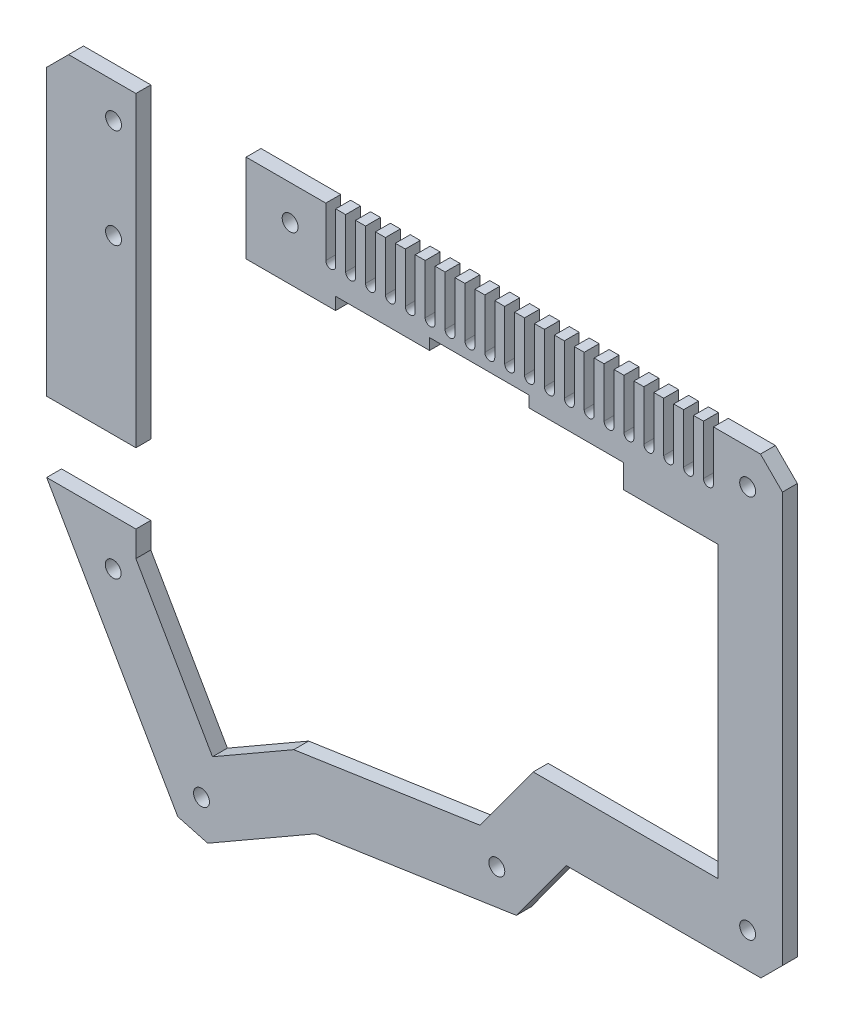
from build123d import *

# Parameters (mm, degrees)
ESQUISSE1_R             = 1.6
BOSS_EXTRU_1_DEPTH      = 3
ENL_V_MAT_EXTRU_1_DEPTH = 10
ESQUISSE3_W             = 19.456160795
ESQUISSE3_H             = 14.150463698
ENL_V_MAT_EXTRU_2_DEPTH = 10


with BuildPart() as part:
    # Esquisse1 → Boss.-Extru.1 (new body)
    with BuildSketch(Plane.XY):
        Polygon((-119.346315028, 5.320852512), (-119.346315028, 1.570515597), (-119.346382005, -12.429484403), (-101.345774335, -12.429484403), (-101.345774335, -9.929307079), (-82.434988213, -9.929307079), (-82.434988213, -7.679926158), (-62.433711482, -7.681038584), (-62.433711482, -9.929307079), (-43.432363825, -9.929307079), (-43.432363825, -14.679643994), (-24.429668504, -14.679643994), (-24.429668504, -72.933633781), (-61.577157206, -72.933633781), (-72.263087593, -87.572177036), (-109.761976756, -93.1463556), (-126.111124489, -102.556497988), (-141.52282508, -75.732017442), (-141.52282508, 5.320852512), (-155.064772313, 5.320852512), (-159.478985875, 0.90663895), (-159.478985875, -70.574320891), (-133.100653393, -116.486520024), (-127.076613358, -118.11178196), (-105.412894174, -105.642711064), (-64.97062335, -99.631001274), (-54.971738012, -85.933633781), (-15.753320523, -85.933633781), (-11.429668504, -81.609981762), (-11.429668504, 0.900815081), (-15.84946011, 5.320852512), align=None)
        with Locations((-146.02282508, -21.680525068)):
            Circle(ESQUISSE1_R, mode=Mode.SUBTRACT)
        with Locations((-18.429668504, -1.684542717)):
            Circle(ESQUISSE1_R, mode=Mode.SUBTRACT)
        with Locations((-110.487646531, -1.678365923)):
            Circle(ESQUISSE1_R, mode=Mode.SUBTRACT)
        with Locations((-146.02282508, -1.677868186)):
            Circle(ESQUISSE1_R, mode=Mode.SUBTRACT)
        with Locations((-146.0923789, -79.822656053)):
            Circle(ESQUISSE1_R, mode=Mode.SUBTRACT)
        with Locations((-128.322250168, -110.752044388)):
            Circle(ESQUISSE1_R, mode=Mode.SUBTRACT)
        with Locations((-68.897334865, -93.137788223)):
            Circle(ESQUISSE1_R, mode=Mode.SUBTRACT)
        with Locations((-18.429668504, -78.933633781)):
            Circle(ESQUISSE1_R, mode=Mode.SUBTRACT)
    extrude(amount=BOSS_EXTRU_1_DEPTH)

    # Esquisse2 → Enlèv. mat.-Extru.1 (cut)
    with BuildSketch(Plane.XY.offset(3)):
        with BuildLine():
            Line((-25.315456398, 8.615924369), (-25.315456398, -4.679147488))
            ThreePointArc((-25.315456398, -4.679147488), (-26.315456398, -5.679147488), (-27.315456398, -4.679147488))
            Line((-27.315456398, -4.679147488), (-27.315456398, 8.615924369))
            ThreePointArc((-27.315456398, 8.615924369), (-26.315456398, 9.615924369), (-25.315456398, 8.615924369))
        make_face()
        with BuildLine():
            Line((-29.315456398, 8.615924369), (-29.315456398, -4.679147488))
            ThreePointArc((-29.315456398, -4.679147488), (-30.315456398, -5.679147488), (-31.315456398, -4.679147488))
            Line((-31.315456398, -4.679147488), (-31.315456398, 8.615924369))
            ThreePointArc((-31.315456398, 8.615924369), (-30.315456398, 9.615924369), (-29.315456398, 8.615924369))
        make_face()
        with BuildLine():
            Line((-33.315456398, 8.615924369), (-33.315456398, -4.679147488))
            ThreePointArc((-33.315456398, -4.679147488), (-34.315456398, -5.679147488), (-35.315456398, -4.679147488))
            Line((-35.315456398, -4.679147488), (-35.315456398, 8.615924369))
            ThreePointArc((-35.315456398, 8.615924369), (-34.315456398, 9.615924369), (-33.315456398, 8.615924369))
        make_face()
        with BuildLine():
            Line((-37.315456398, 8.615924369), (-37.315456398, -4.679147488))
            ThreePointArc((-37.315456398, -4.679147488), (-38.315456398, -5.679147488), (-39.315456398, -4.679147488))
            Line((-39.315456398, -4.679147488), (-39.315456398, 8.615924369))
            ThreePointArc((-39.315456398, 8.615924369), (-38.315456398, 9.615924369), (-37.315456398, 8.615924369))
        make_face()
        with BuildLine():
            Line((-41.315456398, 8.615924369), (-41.315456398, -4.679147488))
            ThreePointArc((-41.315456398, -4.679147488), (-42.315456398, -5.679147488), (-43.315456398, -4.679147488))
            Line((-43.315456398, -4.679147488), (-43.315456398, 8.615924369))
            ThreePointArc((-43.315456398, 8.615924369), (-42.315456398, 9.615924369), (-41.315456398, 8.615924369))
        make_face()
        with BuildLine():
            Line((-45.315456398, 8.615924369), (-45.315456398, -4.679147488))
            ThreePointArc((-45.315456398, -4.679147488), (-46.315456398, -5.679147488), (-47.315456398, -4.679147488))
            Line((-47.315456398, -4.679147488), (-47.315456398, 8.615924369))
            ThreePointArc((-47.315456398, 8.615924369), (-46.315456398, 9.615924369), (-45.315456398, 8.615924369))
        make_face()
        with BuildLine():
            Line((-49.315456398, 8.615924369), (-49.315456398, -4.679147488))
            ThreePointArc((-49.315456398, -4.679147488), (-50.315456398, -5.679147488), (-51.315456398, -4.679147488))
            Line((-51.315456398, -4.679147488), (-51.315456398, 8.615924369))
            ThreePointArc((-51.315456398, 8.615924369), (-50.315456398, 9.615924369), (-49.315456398, 8.615924369))
        make_face()
        with BuildLine():
            Line((-53.315456398, 8.615924369), (-53.315456398, -4.679147488))
            ThreePointArc((-53.315456398, -4.679147488), (-54.315456398, -5.679147488), (-55.315456398, -4.679147488))
            Line((-55.315456398, -4.679147488), (-55.315456398, 8.615924369))
            ThreePointArc((-55.315456398, 8.615924369), (-54.315456398, 9.615924369), (-53.315456398, 8.615924369))
        make_face()
        with BuildLine():
            Line((-57.315456398, 8.615924369), (-57.315456398, -4.679147488))
            ThreePointArc((-57.315456398, -4.679147488), (-58.315456398, -5.679147488), (-59.315456398, -4.679147488))
            Line((-59.315456398, -4.679147488), (-59.315456398, 8.615924369))
            ThreePointArc((-59.315456398, 8.615924369), (-58.315456398, 9.615924369), (-57.315456398, 8.615924369))
        make_face()
        with BuildLine():
            Line((-61.315456398, 8.615924369), (-61.315456398, -4.679147488))
            ThreePointArc((-61.315456398, -4.679147488), (-62.315456398, -5.679147488), (-63.315456398, -4.679147488))
            Line((-63.315456398, -4.679147488), (-63.315456398, 8.615924369))
            ThreePointArc((-63.315456398, 8.615924369), (-62.315456398, 9.615924369), (-61.315456398, 8.615924369))
        make_face()
        with BuildLine():
            Line((-65.315456398, 8.615924369), (-65.315456398, -4.679147488))
            ThreePointArc((-65.315456398, -4.679147488), (-66.315456398, -5.679147488), (-67.315456398, -4.679147488))
            Line((-67.315456398, -4.679147488), (-67.315456398, 8.615924369))
            ThreePointArc((-67.315456398, 8.615924369), (-66.315456398, 9.615924369), (-65.315456398, 8.615924369))
        make_face()
        with BuildLine():
            Line((-69.315456398, 8.615924369), (-69.315456398, -4.679147488))
            ThreePointArc((-69.315456398, -4.679147488), (-70.315456398, -5.679147488), (-71.315456398, -4.679147488))
            Line((-71.315456398, -4.679147488), (-71.315456398, 8.615924369))
            ThreePointArc((-71.315456398, 8.615924369), (-70.315456398, 9.615924369), (-69.315456398, 8.615924369))
        make_face()
        with BuildLine():
            Line((-73.315456398, 8.615924369), (-73.315456398, -4.679147488))
            ThreePointArc((-73.315456398, -4.679147488), (-74.315456398, -5.679147488), (-75.315456398, -4.679147488))
            Line((-75.315456398, -4.679147488), (-75.315456398, 8.615924369))
            ThreePointArc((-75.315456398, 8.615924369), (-74.315456398, 9.615924369), (-73.315456398, 8.615924369))
        make_face()
        with BuildLine():
            Line((-77.315456398, 8.615924369), (-77.315456398, -4.679147488))
            ThreePointArc((-77.315456398, -4.679147488), (-78.315456398, -5.679147488), (-79.315456398, -4.679147488))
            Line((-79.315456398, -4.679147488), (-79.315456398, 8.615924369))
            ThreePointArc((-79.315456398, 8.615924369), (-78.315456398, 9.615924369), (-77.315456398, 8.615924369))
        make_face()
        with BuildLine():
            Line((-81.315456398, 8.615924369), (-81.315456398, -4.679147488))
            ThreePointArc((-81.315456398, -4.679147488), (-82.315456398, -5.679147488), (-83.315456398, -4.679147488))
            Line((-83.315456398, -4.679147488), (-83.315456398, 8.615924369))
            ThreePointArc((-83.315456398, 8.615924369), (-82.315456398, 9.615924369), (-81.315456398, 8.615924369))
        make_face()
        with BuildLine():
            Line((-85.315456398, 8.615924369), (-85.315456398, -4.679147488))
            ThreePointArc((-85.315456398, -4.679147488), (-86.315456398, -5.679147488), (-87.315456398, -4.679147488))
            Line((-87.315456398, -4.679147488), (-87.315456398, 8.615924369))
            ThreePointArc((-87.315456398, 8.615924369), (-86.315456398, 9.615924369), (-85.315456398, 8.615924369))
        make_face()
        with BuildLine():
            Line((-89.315456398, 8.615924369), (-89.315456398, -4.679147488))
            ThreePointArc((-89.315456398, -4.679147488), (-90.315456398, -5.679147488), (-91.315456398, -4.679147488))
            Line((-91.315456398, -4.679147488), (-91.315456398, 8.615924369))
            ThreePointArc((-91.315456398, 8.615924369), (-90.315456398, 9.615924369), (-89.315456398, 8.615924369))
        make_face()
        with BuildLine():
            Line((-93.315456398, 8.615924369), (-93.315456398, -4.679147488))
            ThreePointArc((-93.315456398, -4.679147488), (-94.315456398, -5.679147488), (-95.315456398, -4.679147488))
            Line((-95.315456398, -4.679147488), (-95.315456398, 8.615924369))
            ThreePointArc((-95.315456398, 8.615924369), (-94.315456398, 9.615924369), (-93.315456398, 8.615924369))
        make_face()
        with BuildLine():
            Line((-97.315456398, 8.615924369), (-97.315456398, -4.679147488))
            ThreePointArc((-97.315456398, -4.679147488), (-98.315456398, -5.679147488), (-99.315456398, -4.679147488))
            Line((-99.315456398, -4.679147488), (-99.315456398, 8.615924369))
            ThreePointArc((-99.315456398, 8.615924369), (-98.315456398, 9.615924369), (-97.315456398, 8.615924369))
        make_face()
        with BuildLine():
            Line((-101.315456398, 8.615924369), (-101.315456398, -4.679147488))
            ThreePointArc((-101.315456398, -4.679147488), (-102.315456398, -5.679147488), (-103.315456398, -4.679147488))
            Line((-103.315456398, -4.679147488), (-103.315456398, 8.615924369))
            ThreePointArc((-103.315456398, 8.615924369), (-102.315456398, 9.615924369), (-101.315456398, 8.615924369))
        make_face()
    extrude(amount=-ENL_V_MAT_EXTRU_1_DEPTH, mode=Mode.SUBTRACT)

    # Esquisse3 → Enlèv. mat.-Extru.2 (cut)
    with BuildSketch(Plane.XY.offset(3)):
        with Locations((-149.750905477, -63.499089042)):
            Rectangle(ESQUISSE3_W, ESQUISSE3_H)
    extrude(amount=-ENL_V_MAT_EXTRU_2_DEPTH, mode=Mode.SUBTRACT)


with BuildPart() as enl_v_mat_extru_2_piece_1:
    # of the separate pieces the step leaves, piece 1, a body of its own (enl_v_mat_extru_2_pieces)
    add(part.part.solids().sort_by_distance((-11.429668504, 0.900815081, 0))[0])


with BuildPart() as enl_v_mat_extru_2_piece_2:
    # of the separate pieces the step leaves, piece 2, a body of its own (enl_v_mat_extru_2_pieces)
    add(part.part.solids().sort_by_distance((-159.478985875, 0.90663895, 0))[0])


solid = Compound([enl_v_mat_extru_2_piece_1.part, enl_v_mat_extru_2_piece_2.part])
